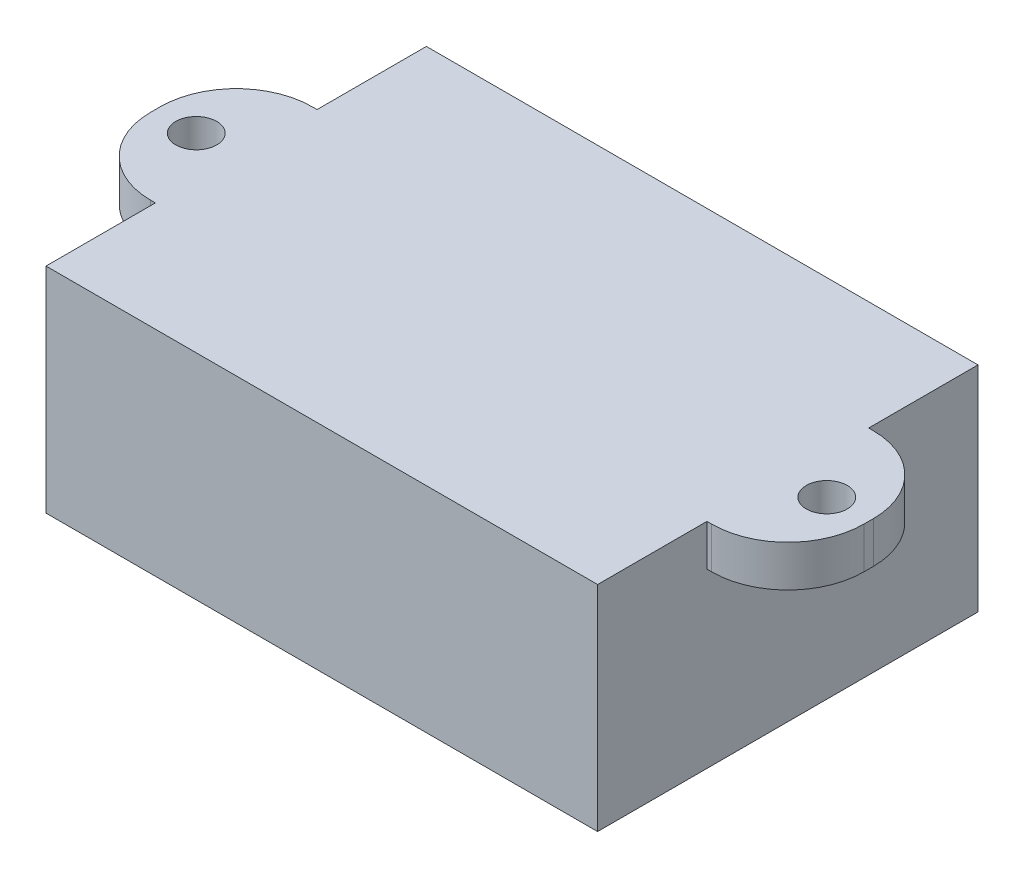
from build123d import *

# Parameters (mm, degrees)
SKETCH1_W           = 58
SKETCH1_H           = 40
BOSS_EXTRUDE1_DEPTH = 22.5
SKETCH2_W           = 8.5
SKETCH2_H           = 17
SKETCH2_R           = 2.15
BOSS_EXTRUDE2_DEPTH = 4.35
FILLET1_R           = 8


with BuildPart() as part:
    # Sketch1 → Boss-Extrude1 (new body)
    with BuildSketch(Plane(origin=(0, 0, 0), x_dir=(1, 0, 0), z_dir=(0, 1, 0))):
        with Locations((29, -20)):
            Rectangle(SKETCH1_W, SKETCH1_H)
    extrude(amount=BOSS_EXTRUDE1_DEPTH)

    # Sketch2 → Boss-Extrude2 (add)
    # profile 1 of 2: a face of its own
    with BuildSketch(Plane(origin=(0, 22.5, 0), x_dir=(1, 0, 0), z_dir=(0, 1, 0))):
        with Locations((62.25, -20)):
            Rectangle(SKETCH2_W, SKETCH2_H)
        with Locations(Location((62.1, -20, 0), (0, 0, 270))):
            Circle(SKETCH2_R, mode=Mode.SUBTRACT)
    # profile 2 of 2: a face of its own
    with BuildSketch(Plane(origin=(0, 22.5, 0), x_dir=(1, 0, 0), z_dir=(0, 1, 0))):
        with Locations((-4.25, -20)):
            Rectangle(SKETCH2_W, SKETCH2_H)
        with Locations(Location((-4.2, -20, 0), (0, 0, 270))):
            Circle(SKETCH2_R, mode=Mode.SUBTRACT)
    extrude(amount=-BOSS_EXTRUDE2_DEPTH)

    # Fillet1
    fillet1_edges = [part.edges().sort_by_distance(p)[0] for p in [
        (66.5, 20.325, 11.5),
        (66.5, 20.325, 28.5),
        (-8.5, 20.325, 28.5),
        (-8.5, 20.325, 11.5),
    ]]
    fillet(fillet1_edges, radius=FILLET1_R)


solid = part.part
